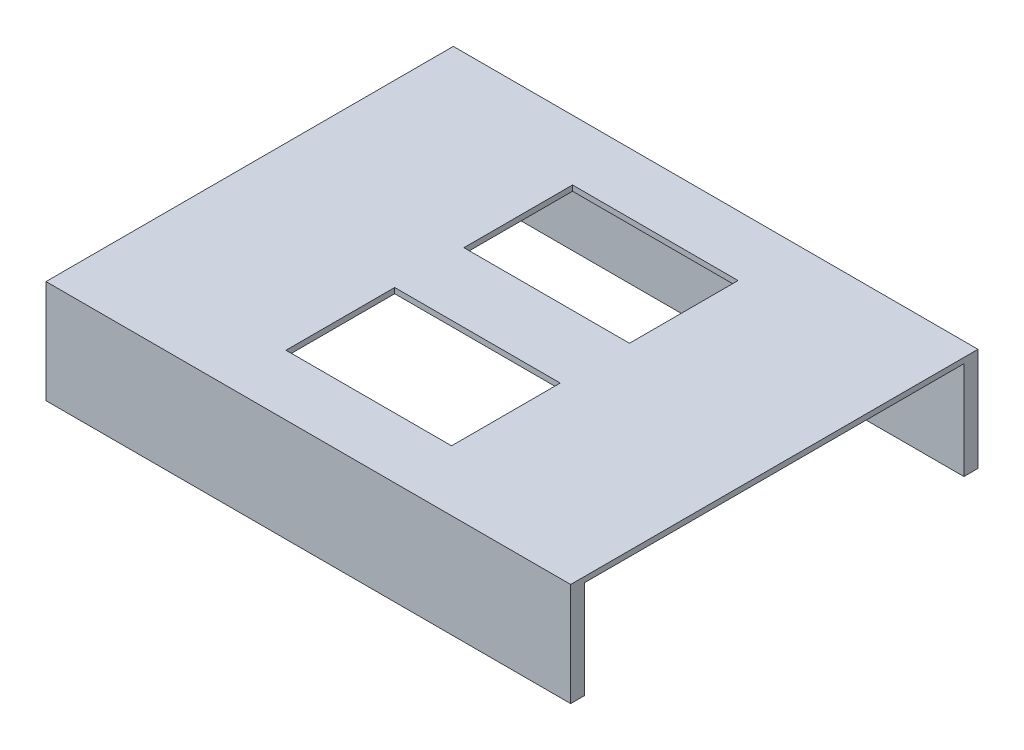
from build123d import *

# Parameters (mm, degrees)
SKETCH1_W           = 483
SKETCH1_H           = 375
BOSS_EXTRUDE1_DEPTH = 95
SKETCH2_W           = 349.080578543
SKETCH2_H           = 90
CUT_EXTRUDE1_DEPTH  = 531.118
SKETCH3_W           = 152.4
SKETCH3_H           = 100
SKETCH3_H_2         = 100.076
CUT_EXTRUDE2_DEPTH  = 531.118


with BuildPart() as part:
    # Sketch1 → Boss-Extrude1 (new body)
    with BuildSketch(Plane(origin=(0, 0, 0), x_dir=(1, 0, 0), z_dir=(0, 1, 0))):
        with Locations((25.017350158, -85.764984227)):
            Rectangle(SKETCH1_W, SKETCH1_H)
    extrude(amount=BOSS_EXTRUDE1_DEPTH)

    # Sketch2 → Cut-Extrude1 (cut)
    with BuildSketch(Plane.ZY.offset(216.482649842)):
        with Locations((85.770694956, 45)):
            Rectangle(SKETCH2_W, SKETCH2_H)
    extrude(amount=-CUT_EXTRUDE1_DEPTH, mode=Mode.SUBTRACT)

    # Sketch3 → Cut-Extrude2 (cut)
    with BuildSketch(Plane(origin=(0, 95, 0), x_dir=(1, 0, 0), z_dir=(0, 1, 0))):
        with Locations((25.071350158, -3.890984227)):
            Rectangle(SKETCH3_W, SKETCH3_H)
        with Locations((24.944350158, -167.516369345)):
            Rectangle(SKETCH3_W, SKETCH3_H_2)
    extrude(amount=-CUT_EXTRUDE2_DEPTH, mode=Mode.SUBTRACT)


solid = part.part
